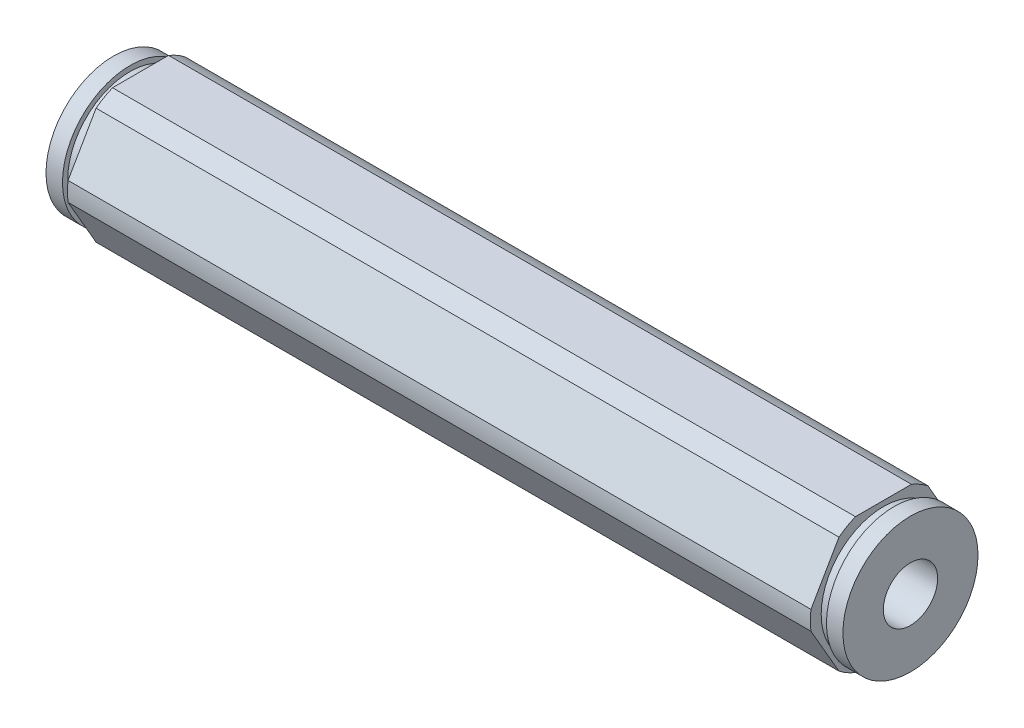
from build123d import *

# Parameters (mm, degrees)
BOSS_EXTRUDE1_DEPTH = 37.465
SKETCH3_R           = 7.332348419
SKETCH3_R_2         = 6.875
SKETCH3_R_3         = 2.5527
CUT_EXTRUDE1_DEPTH  = 76.555216453


with BuildPart() as part:
    # Sketch1 → Boss-Extrude1 (new, symmetric)
    with BuildSketch(Plane(origin=(0, 0, 0), x_dir=(0, 0, -1), z_dir=(1, 0, 0))):
        Polygon((7.332348419, 0), (3.666174209, 6.35), (-3.666174209, 6.35), (-7.332348419, 0), (-3.666174209, -6.35), (3.666174209, -6.35), align=None)
    extrude(amount=BOSS_EXTRUDE1_DEPTH, both=True)

    # Sketch2 → Cut-Revolve1 (revolve, cut)
    with BuildSketch(Plane(origin=(0, 0, 0), x_dir=(1, 0, 0), z_dir=(0, 1, 0))):
        Polygon((34.925, -5.8547), (35.9156, -5.8547), (35.9156, -6.35), (37.465, -6.35), (37.465, -8.89), (34.925, -8.89), align=None)
    cut_revolve1 = revolve(axis=Axis((0, 0, 0), (1, 0, 0)), mode=Mode.SUBTRACT)

    # Mirror1: Cut-Revolve1 across plane
    add(cut_revolve1.mirror(Plane(origin=(0, 0, 0), x_dir=(0, 0, 1), z_dir=(1, 0, 0))), mode=Mode.SUBTRACT)

    # Sketch3 → Cut-Extrude1 (cut, through all)
    # profile 1 of 2: a face of its own
    with BuildSketch(Plane(origin=(37.465, 0, 0), x_dir=(0, 0, -1), z_dir=(1, 0, 0))):
        Circle(SKETCH3_R)
        Circle(SKETCH3_R_2, mode=Mode.SUBTRACT)
    # profile 2 of 2: a face of its own
    with BuildSketch(Plane(origin=(37.465, 0, 0), x_dir=(0, 0, -1), z_dir=(1, 0, 0))):
        Circle(SKETCH3_R_3)
    extrude(amount=-CUT_EXTRUDE1_DEPTH, mode=Mode.SUBTRACT)


solid = part.part
